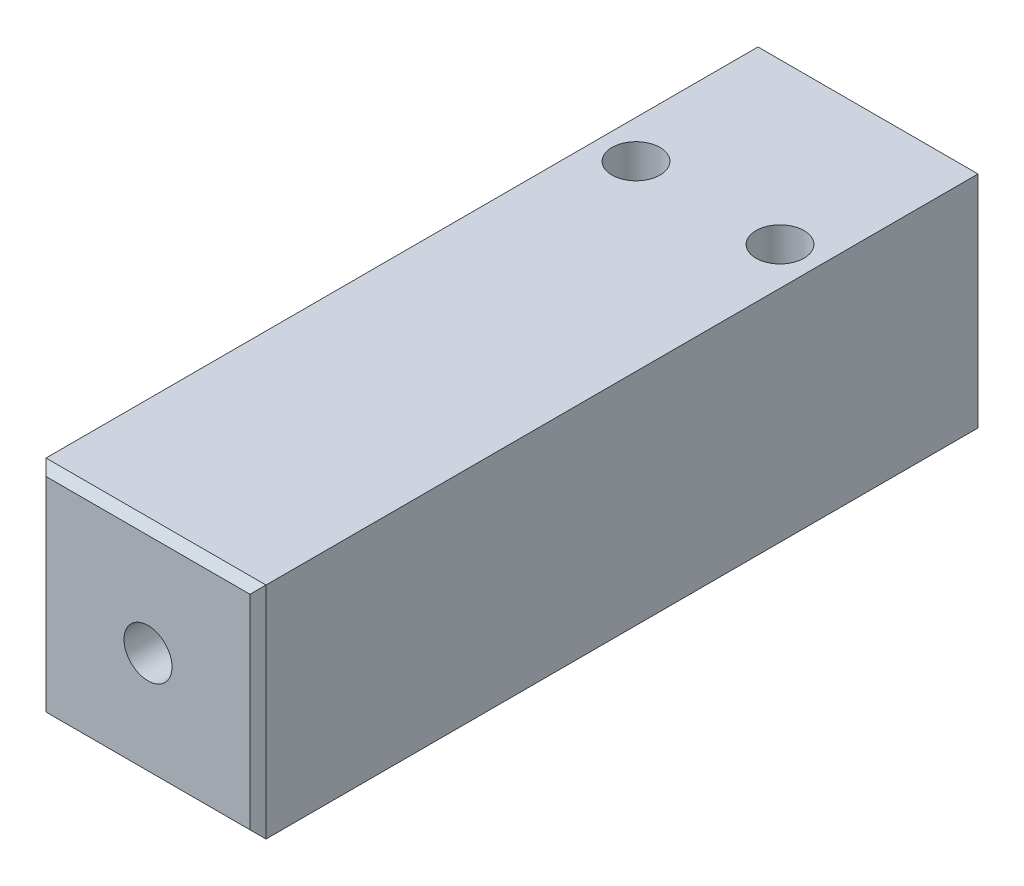
from build123d import *

# Parameters (mm, degrees)
CROQUIS1_W              = 55
CROQUIS1_H              = 55
SALIENTE_EXTRUIR1_DEPTH = 180
CROQUIS2_R              = 6
CORTAR_EXTRUIR1_DEPTH   = 30
CROQUIS3_R              = 4
CORTAR_EXTRUIR2_DEPTH   = 25
CROQUIS6_R              = 6
CORTAR_EXTRUIR5_DEPTH   = 12
CHAFL_N1_SIZE           = 2


with BuildPart() as part:
    # Croquis1 → Saliente-Extruir1 (new body)
    with BuildSketch(Plane.XY):
        Rectangle(CROQUIS1_W, CROQUIS1_H)
    extrude(amount=-SALIENTE_EXTRUIR1_DEPTH)

    # Croquis2 → Cortar-Extruir1 (cut)
    with BuildSketch(Plane.XY):
        Circle(CROQUIS2_R)
    extrude(amount=-CORTAR_EXTRUIR1_DEPTH, mode=Mode.SUBTRACT)

    # Croquis3 → Cortar-Extruir2 (cut)
    with BuildSketch(Plane(origin=(0, 0, -180), x_dir=(-1, 0, 0), z_dir=(0, 0, -1))):
        with Locations((18, 18)):
            Circle(CROQUIS3_R)
        with Locations((-18, 18)):
            Circle(CROQUIS3_R)
        with Locations((-18, -18)):
            Circle(CROQUIS3_R)
        with Locations((18, -18)):
            Circle(CROQUIS3_R)
    extrude(amount=-CORTAR_EXTRUIR2_DEPTH, mode=Mode.SUBTRACT)

    # Croquis6 → Cortar-Extruir5 (cut)
    with BuildSketch(Plane(origin=(0, 27.5, 0), x_dir=(1, 0, 0), z_dir=(0, 1, 0))):
        with Locations(Location((-18, 140, 0), (0, 0, 270))):
            Circle(CROQUIS6_R)
        with Locations(Location((18, 140, 0), (0, 0, 270))):
            Circle(CROQUIS6_R)
    extrude(amount=-CORTAR_EXTRUIR5_DEPTH, mode=Mode.SUBTRACT)

    # Chaflán1
    chafl_n1_edges = [part.edges().sort_by_distance(p)[0] for p in [
        (0, -27.5, 0),
        (-27.5, 0, 0),
        (0, 27.5, 0),
        (27.5, 0, 0),
    ]]
    chamfer(chafl_n1_edges, length=CHAFL_N1_SIZE)


solid = part.part
